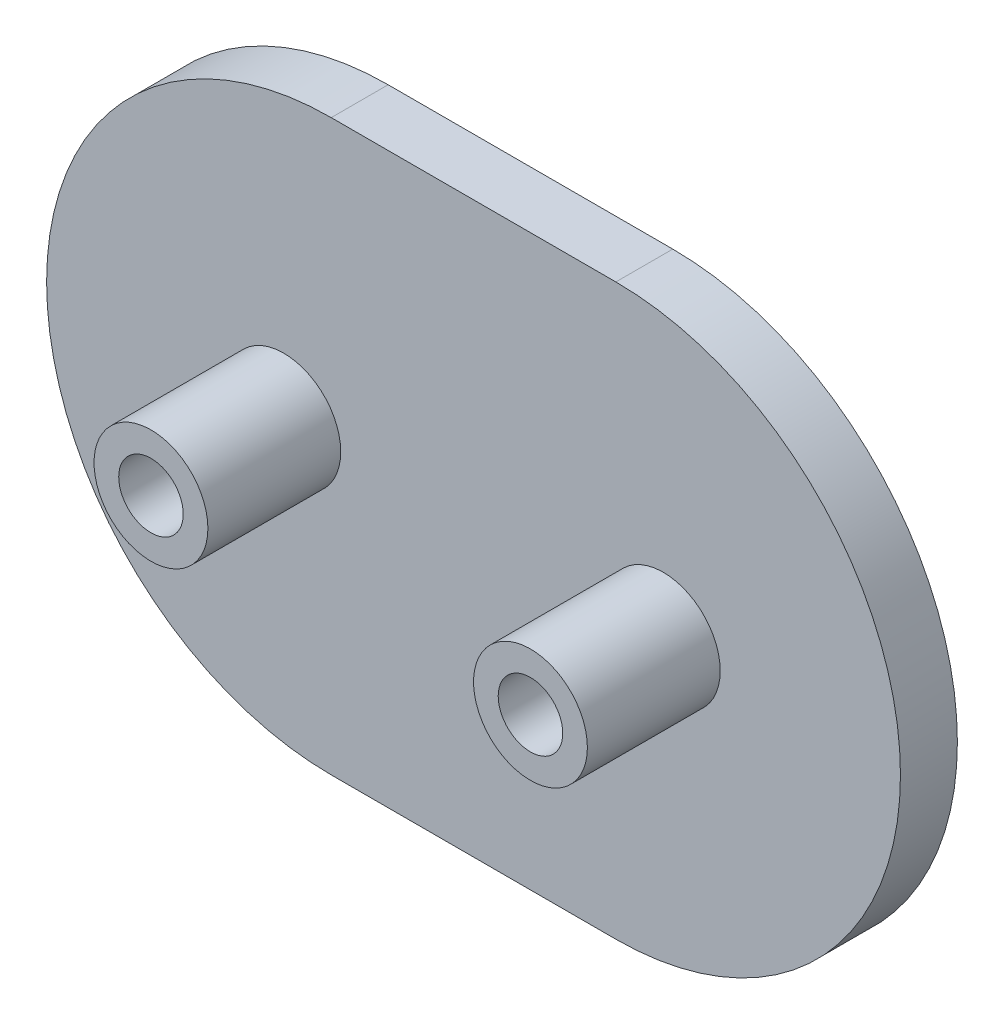
from build123d import *

# Parameters (mm, degrees)
SKETCH_1_R      = 3
EXTRUDE_1_DEPTH = 3
SKETCH_1_3_R    = 3
SKETCH_1_3_R_2  = 1.7
EXTRUDE_2_DEPTH = 10
CHAMFER_1_SIZE  = 1.4


with BuildPart() as part:
    # 草图1 → 凸台-拉伸1 (new body)
    with BuildSketch(Plane.XY):
        with BuildLine():
            Line((7.5, 15), (-7.5, 15))
            ThreePointArc((-7.5, 15), (-22.5, 0), (-7.5, -15))
            Line((-7.5, -15), (7.5, -15))
            ThreePointArc((7.5, -15), (22.5, 0), (7.5, 15))
        make_face()
        with Locations((-10, 0)):
            Circle(SKETCH_1_R, mode=Mode.SUBTRACT)
        with Locations((10, 0)):
            Circle(SKETCH_1_R, mode=Mode.SUBTRACT)
    extrude(amount=EXTRUDE_1_DEPTH)

    # 草图1<3> → 凸台-拉伸2 (add)
    # profile 1 of 2: a face of its own
    with BuildSketch(Plane.XY):
        with Locations((-10, 0)):
            Circle(SKETCH_1_3_R)
        with Locations((-10, 0)):
            Circle(SKETCH_1_3_R_2, mode=Mode.SUBTRACT)
    # profile 2 of 2: a face of its own
    with BuildSketch(Plane.XY):
        with Locations((10, 0)):
            Circle(SKETCH_1_3_R)
        with Locations((10, 0)):
            Circle(SKETCH_1_3_R_2, mode=Mode.SUBTRACT)
    extrude(amount=EXTRUDE_2_DEPTH)

    # 倒角1
    chamfer_1_edges = [part.edges().sort_by_distance(p)[0] for p in [
        (8.3, 0, 0),
        (-11.7, 0, 0),
    ]]
    chamfer(chamfer_1_edges, length=CHAMFER_1_SIZE)


solid = part.part
